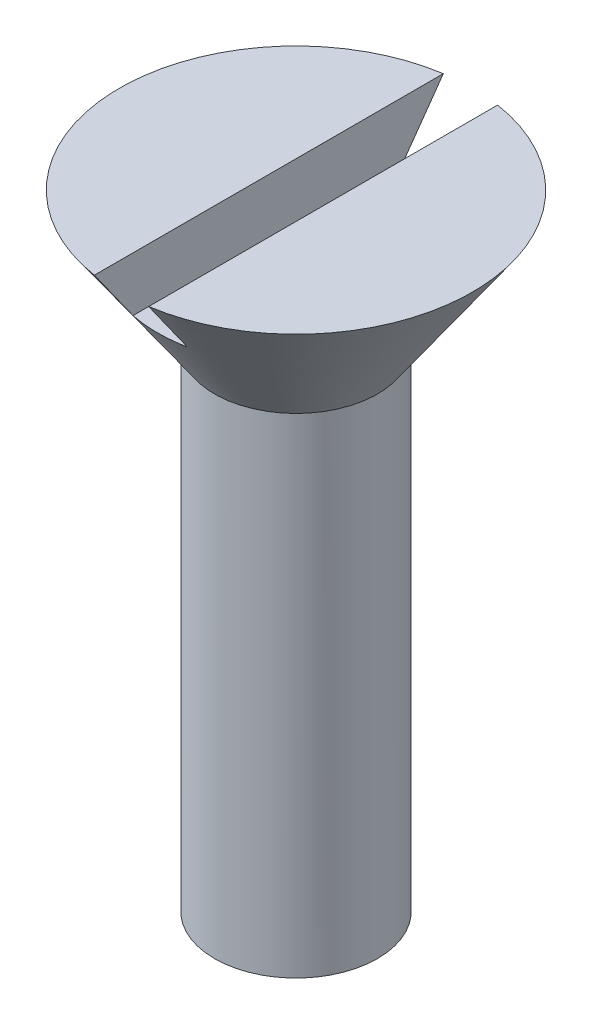
from build123d import *

# Parameters (mm, degrees)
SKETCH2_W          = 2
SKETCH2_H          = 4
CUT_EXTRUDE1_DEPTH = 8


with BuildPart() as part:
    # Sketch1 → Revolve1 (revolve)
    with BuildSketch(Plane.XY, mode=Mode.PRIVATE) as revolve1_sk:
        Polygon((0, 0), (6.5, 0), (3, -5), (3, -23), (0, -24.732050808), align=None)
    revolve(revolve1_sk.sketch.rotate(Axis((0, -24.732050808, 0), (0, 1, 0)), 90), axis=Axis((0, -24.732050808, 0), (0, 1, 0)))

    # Sketch2 → Cut-Extrude1 (cut, symmetric)
    with BuildSketch(Plane.XY):
        Rectangle(SKETCH2_W, SKETCH2_H)
    extrude(amount=CUT_EXTRUDE1_DEPTH, both=True, mode=Mode.SUBTRACT)


solid = part.part
